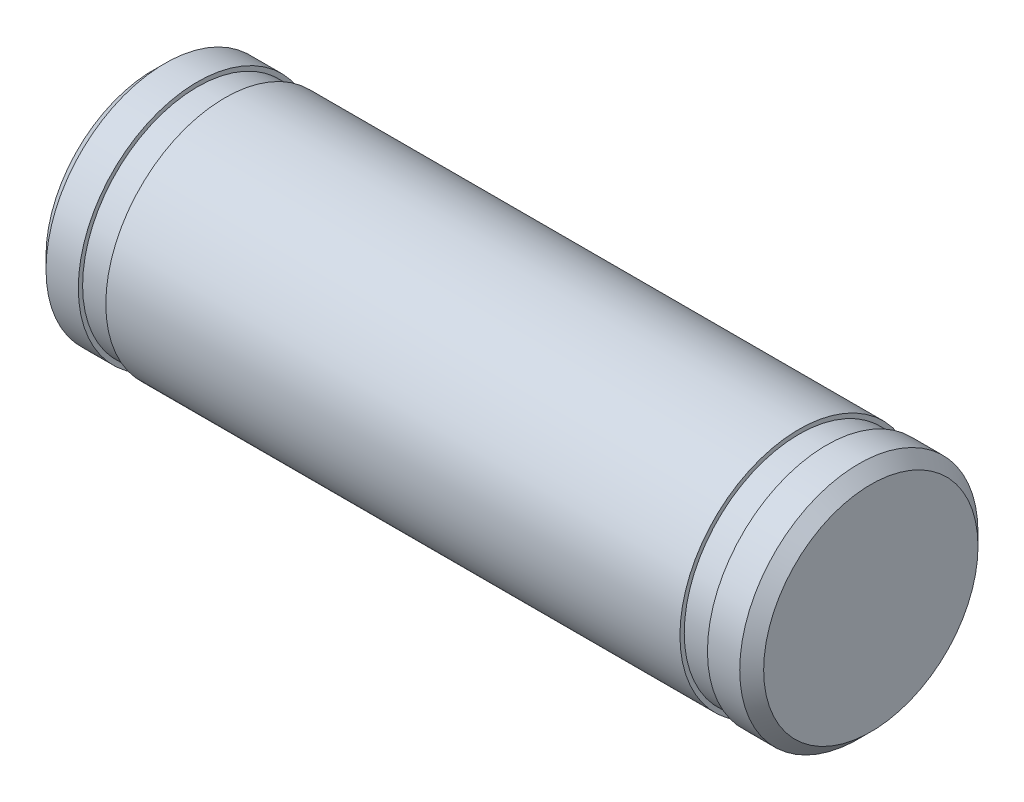
from build123d import *

# Parameters (mm, degrees)
SKETCH1_R           = 4.98
BOSS_EXTRUDE1_DEPTH = 15
CUT_EXTRUDE1_START  = -3
SKETCH2_R           = 4.98
SKETCH2_R_2         = 4.8
CUT_EXTRUDE1_DEPTH  = 1.15
CHAMFER1_SIZE       = 0.5
CHAMFER2_SIZE       = 0.5


with BuildPart() as part:
    # Sketch1 → Boss-Extrude1 (new, symmetric)
    with BuildSketch(Plane(origin=(0, 0, 0), x_dir=(0, 0, -1), z_dir=(1, 0, 0))):
        Circle(SKETCH1_R)
    extrude(amount=BOSS_EXTRUDE1_DEPTH, both=True)

    # Sketch2 → Cut-Extrude1 (cut)
    with BuildSketch(Plane.ZY.offset(15).offset(CUT_EXTRUDE1_START)):
        Circle(SKETCH2_R)
        Circle(SKETCH2_R_2, mode=Mode.SUBTRACT)
    cut_extrude1 = extrude(amount=CUT_EXTRUDE1_DEPTH, mode=Mode.SUBTRACT)

    # Chamfer1
    chamfer1_edges = [part.edges().sort_by_distance(p)[0] for p in [
        (-15, 0, 4.98),
    ]]
    chamfer(chamfer1_edges, length=CHAMFER1_SIZE)

    # Mirror1: Cut-Extrude1 across plane
    add(cut_extrude1.mirror(Plane(origin=(0, 0, 0), x_dir=(0, 0, 1), z_dir=(1, 0, 0))), mode=Mode.SUBTRACT)

    # Chamfer2
    chamfer2_edges = [part.edges().sort_by_distance(p)[0] for p in [
        (15, 0, 4.98),
    ]]
    chamfer(chamfer2_edges, length=CHAMFER2_SIZE)


solid = part.part
